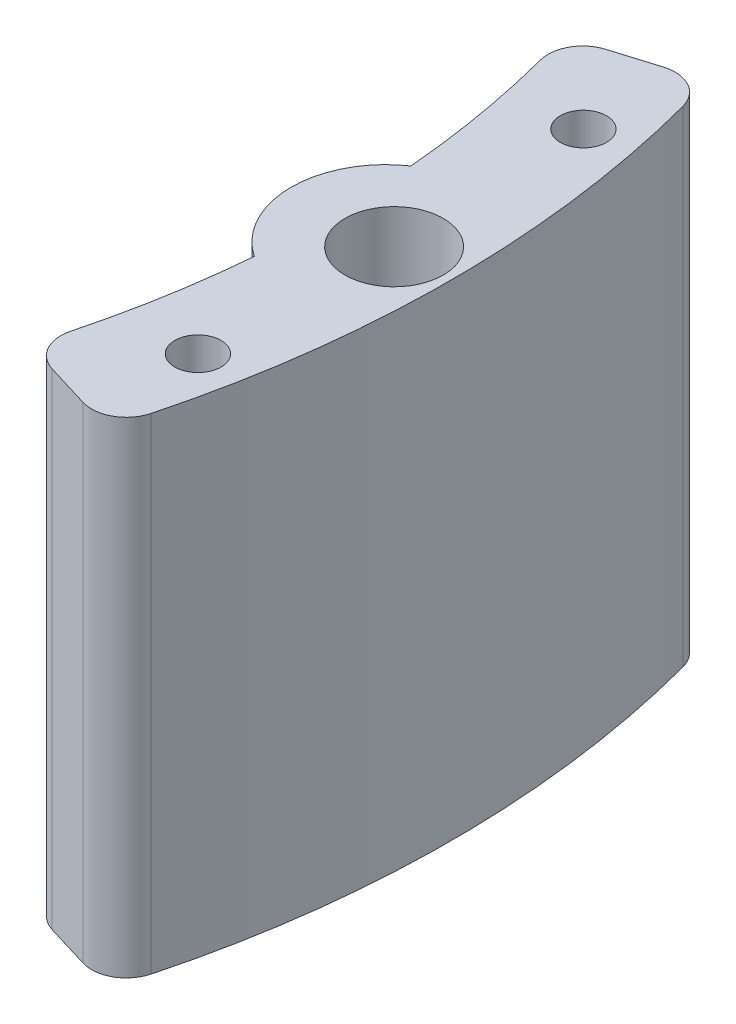
from build123d import *

# Parameters (mm, degrees)
BOSS_EXTRUDE1_DEPTH = 42
FILLET1_R           = 3
SKETCH3_R           = 4.25
CUT_EXTRUDE1_DEPTH  = 50.500549163
BOSS_EXTRUDE2_DEPTH = 42
CUT_EXTRUDE2_DEPTH  = 50.678098566


with BuildPart() as part:
    # Sketch1 → Boss-Extrude1 (new body)
    with BuildSketch(Plane(origin=(0, 0, 0), x_dir=(1, 0, 0), z_dir=(0, 1, 0))):
        with BuildLine():
            Line((-7.705313318, 23.08749092), (1.86118947, 26))
            ThreePointArc((1.86118947, 26), (5.698552556, 0), (1.86118947, -26))
            Line((1.86118947, -26), (-7.705313318, -23.08749092))
            ThreePointArc((-7.705313318, -23.08749092), (-4.301447444, 0), (-7.705313318, 23.08749092))
        make_face()
    extrude(amount=BOSS_EXTRUDE1_DEPTH)

    # Fillet1
    fillet1_edges = [part.edges().sort_by_distance(p)[0] for p in [
        (-7.705313318, 21, -23.08749092),
        (1.86118947, 21, -26),
        (1.86118947, 21, 26),
        (-7.705313318, 21, 23.08749092),
    ]]
    fillet(fillet1_edges, radius=FILLET1_R)

    # Sketch3 → Cut-Extrude1 (cut, through all)
    with BuildSketch(Plane(origin=(0, 42, 0), x_dir=(1, 0, 0), z_dir=(0, 1, 0))):
        with Locations(Location((0.733117745, 0, 0), (0, 0, 270))):
            Circle(SKETCH3_R)
    extrude(amount=-CUT_EXTRUDE1_DEPTH, mode=Mode.SUBTRACT)

    # Sketch4 → Boss-Extrude2 (add)
    with BuildSketch(Plane(origin=(0, 0, 0), x_dir=(1, 0, 0), z_dir=(0, 1, 0))):
        with BuildLine():
            Line((-3.757374772, -7.265548226), (-3.757374772, 7.265548226))
            ThreePointArc((-3.757374772, 7.265548226), (-8.179612228, 0), (-3.757374772, -7.265548226))
        make_face()
    extrude(amount=BOSS_EXTRUDE2_DEPTH)

    # Sketch5 → Cut-Extrude2 (cut, through all)
    with BuildSketch(Plane.XZ):
        with BuildLine():
            ThreePointArc((2.266407335, 16.5), (1.434288795, 18.123592589), (-0.36964556, 18.396163684))
            ThreePointArc((-0.36964556, 18.396163684), (0.266407335, 16.5), (0.832937896, 14.58191681))
            ThreePointArc((0.832937896, 14.58191681), (1.868446836, 15.302724159), (2.266407335, 16.5))
        make_face()
        with BuildLine():
            ThreePointArc((0.832937896, 14.58191681), (0.266407335, 16.5), (-0.36964556, 18.396163684))
            ThreePointArc((-0.36964556, 18.396163684), (-1.641032871, 15.898608399), (0.832937896, 14.58191681))
        make_face()
        with BuildLine():
            ThreePointArc((0.690987711, -15.08742552), (-1.795468684, -16.380384411), (-0.548037667, -18.889990746))
            ThreePointArc((-0.548037667, -18.889990746), (0.106129728, -17), (0.690987711, -15.08742552))
        make_face()
        with BuildLine():
            ThreePointArc((0.690987711, -15.08742552), (0.106129728, -17), (-0.548037667, -18.889990746))
            ThreePointArc((-0.548037667, -18.889990746), (1.266229984, -18.629161562), (2.106129728, -17))
            ThreePointArc((2.106129728, -17), (1.713879081, -15.810402582), (0.690987711, -15.08742552))
        make_face()
    extrude(amount=-CUT_EXTRUDE2_DEPTH, mode=Mode.SUBTRACT)


solid = part.part
